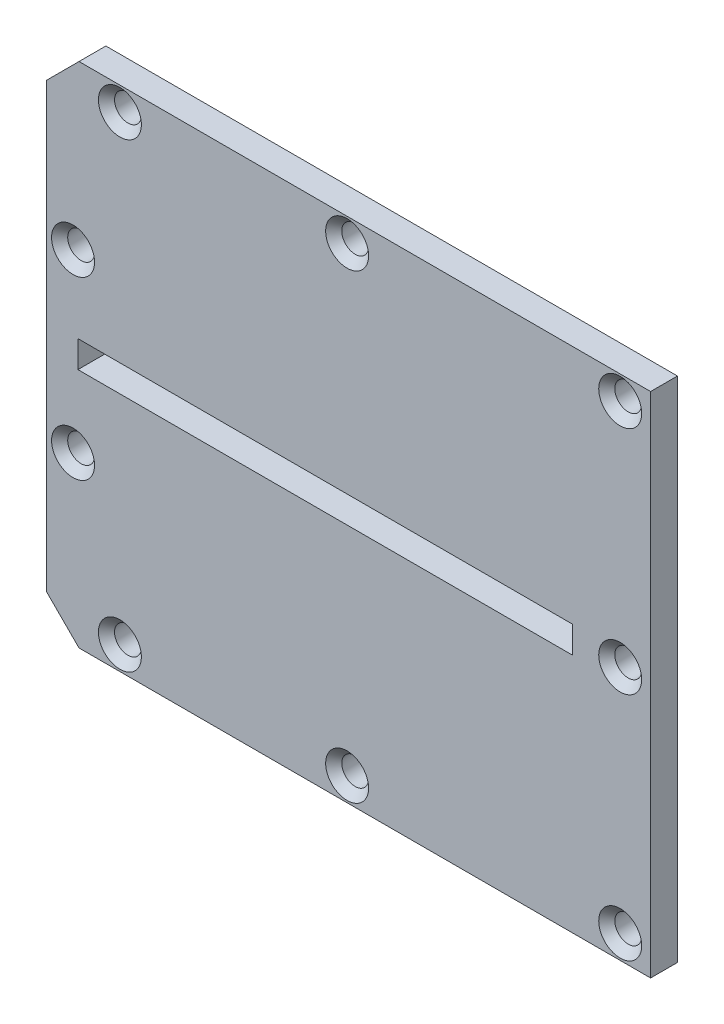
from build123d import *

# Parameters (mm, degrees)
SKETCH1_R           = 1.27
BOSS_EXTRUDE1_DEPTH = 2.54
CHAMFER1_SIZE       = 0.762
SKETCH2_W           = 46.799762806
SKETCH2_H           = 2.54
CUT_EXTRUDE1_DEPTH  = 5.334


with BuildPart() as part:
    # Sketch1 → Boss-Extrude1 (new body)
    with BuildSketch(Plane.XY):
        Polygon((-104.877780152, -24.027219848), (-50.8, -24.027219848), (-50.8, 24.027219848), (-104.877780152, 24.027219848), (-107.95, 20.955), (-107.95, -20.955), align=None)
        with Locations((-101.009537176, 21.805359873)):
            Circle(SKETCH1_R, mode=Mode.SUBTRACT)
        with Locations((-79.51282161, 21.805359873)):
            Circle(SKETCH1_R, mode=Mode.SUBTRACT)
        with Locations((-53.676916467, 21.805359873)):
            Circle(SKETCH1_R, mode=Mode.SUBTRACT)
        with Locations((-53.676916467, 0)):
            Circle(SKETCH1_R, mode=Mode.SUBTRACT)
        with Locations((-53.676916467, -21.805359873)):
            Circle(SKETCH1_R, mode=Mode.SUBTRACT)
        with Locations((-79.51282161, -21.805359873)):
            Circle(SKETCH1_R, mode=Mode.SUBTRACT)
        with Locations((-101.009537176, -21.805359873)):
            Circle(SKETCH1_R, mode=Mode.SUBTRACT)
        with Locations((-105.440631813, -8.320112928)):
            Circle(SKETCH1_R, mode=Mode.SUBTRACT)
        with Locations((-105.440631813, 8.320112928)):
            Circle(SKETCH1_R, mode=Mode.SUBTRACT)
    extrude(amount=BOSS_EXTRUDE1_DEPTH)

    # Chamfer1
    chamfer1_edges = [part.edges().sort_by_distance(p)[0] for p in [
        (-80.78282161, 21.805359873, 2.54),
        (-54.946916467, 21.805359873, 2.54),
        (-102.279537176, 21.805359873, 2.54),
        (-54.946916467, 0, 2.54),
        (-54.946916467, -21.805359873, 2.54),
        (-80.78282161, -21.805359873, 2.54),
        (-102.279537176, -21.805359873, 2.54),
        (-106.710631813, -8.320112928, 2.54),
        (-106.710631813, 8.320112928, 2.54),
    ]]
    chamfer(chamfer1_edges, length=CHAMFER1_SIZE)

    # Sketch2 → Cut-Extrude1 (cut)
    with BuildSketch(Plane.XY.offset(2.54)):
        with Locations((-81.583109387, 0)):
            Rectangle(SKETCH2_W, SKETCH2_H)
    extrude(amount=-CUT_EXTRUDE1_DEPTH, mode=Mode.SUBTRACT)


solid = part.part
